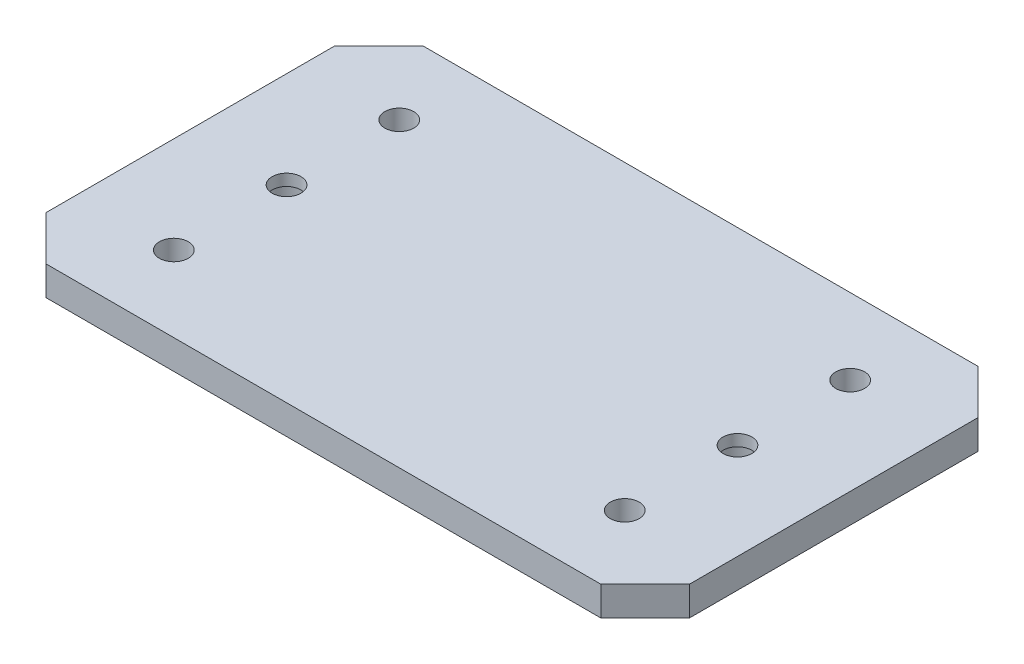
from build123d import *

# Parameters (mm, degrees)
SKETCH1_W           = 145
SKETCH1_H           = 85
BOSS_EXTRUDE1_DEPTH = 6.6
SKETCH2_R           = 3.25
CUT_EXTRUDE1_DEPTH  = 85.297449546
CHAMFER1_SIZE       = 10
CUT_EXTRUDE2_START  = -4
SKETCH3_R           = 5.25
SKETCH3_R_2         = 3.25
CUT_EXTRUDE2_DEPTH  = 4
SKETCH4_R           = 2.25
CUT_EXTRUDE3_DEPTH  = 1.5


with BuildPart() as part:
    # Sketch1 → Boss-Extrude1 (new body)
    with BuildSketch(Plane(origin=(0, 0, 0), x_dir=(1, 0, 0), z_dir=(0, 1, 0))):
        Rectangle(SKETCH1_W, SKETCH1_H)
    extrude(amount=BOSS_EXTRUDE1_DEPTH)

    # Sketch2 → Cut-Extrude1 (cut, through all)
    with BuildSketch(Plane(origin=(0, 6.6, 0), x_dir=(1, 0, 0), z_dir=(0, 1, 0))):
        with Locations(Location((-50.8, 25.4, 0), (0, 0, 270))):
            Circle(SKETCH2_R)
        with Locations(Location((50.8, 25.4, 0), (0, 0, 270))):
            Circle(SKETCH2_R)
        with Locations(Location((50.8, -25.4, 0), (0, 0, 270))):
            Circle(SKETCH2_R)
        with Locations(Location((-50.8, -25.4, 0), (0, 0, 270))):
            Circle(SKETCH2_R)
        with Locations(Location((50.8, 0, 0), (0, 0, 270))):
            Circle(SKETCH2_R)
        with Locations(Location((-50.8, 0, 0), (0, 0, 90))):
            Circle(SKETCH2_R)
    extrude(amount=-CUT_EXTRUDE1_DEPTH, mode=Mode.SUBTRACT)

    # Chamfer1
    chamfer1_edges = [part.edges().sort_by_distance(p)[0] for p in [
        (72.5, 3.3, 42.5),
        (-72.5, 3.3, 42.5),
        (-72.5, 3.3, -42.5),
        (72.5, 3.3, -42.5),
    ]]
    chamfer(chamfer1_edges, length=CHAMFER1_SIZE)

    # Sketch3 → Cut-Extrude2 (cut)
    # profile 1 of 2: a face of its own
    with BuildSketch(Plane.XZ.offset(CUT_EXTRUDE2_START)):
        with Locations(Location((50.8, 0, 0), (0, 0, 270))):
            Circle(SKETCH3_R)
        with Locations(Location((50.8, 0, 0), (0, 0, 90))):
            Circle(SKETCH3_R_2, mode=Mode.SUBTRACT)
    # profile 2 of 2: a face of its own
    with BuildSketch(Plane.XZ.offset(CUT_EXTRUDE2_START)):
        with Locations(Location((-50.8, 0, 0), (0, 0, 270))):
            Circle(SKETCH3_R)
        with Locations(Location((-50.8, 0, 0), (0, 0, 270))):
            Circle(SKETCH3_R_2, mode=Mode.SUBTRACT)
    extrude(amount=CUT_EXTRUDE2_DEPTH, mode=Mode.SUBTRACT)

    # Sketch4 → Cut-Extrude3 (cut)
    with BuildSketch(Plane.XZ):
        with Locations(Location((-25.4, 25.4, 0), (0, 0, 270))):
            Circle(SKETCH4_R)
        with Locations(Location((0, 25.4, 0), (0, 0, 270))):
            Circle(SKETCH4_R)
        with Locations(Location((25.4, 25.4, 0), (0, 0, 270))):
            Circle(SKETCH4_R)
        with Locations(Location((-25.4, 0, 0), (0, 0, 270))):
            Circle(SKETCH4_R)
        with Locations(Location((0, 0, 0), (0, 0, 270))):
            Circle(SKETCH4_R)
        with Locations(Location((25.4, 0, 0), (0, 0, 270))):
            Circle(SKETCH4_R)
        with Locations(Location((-25.4, -25.4, 0), (0, 0, 270))):
            Circle(SKETCH4_R)
        with Locations(Location((0, -25.4, 0), (0, 0, 270))):
            Circle(SKETCH4_R)
        with Locations(Location((25.4, -25.4, 0), (0, 0, 270))):
            Circle(SKETCH4_R)
    extrude(amount=-CUT_EXTRUDE3_DEPTH, mode=Mode.SUBTRACT)


solid = part.part
